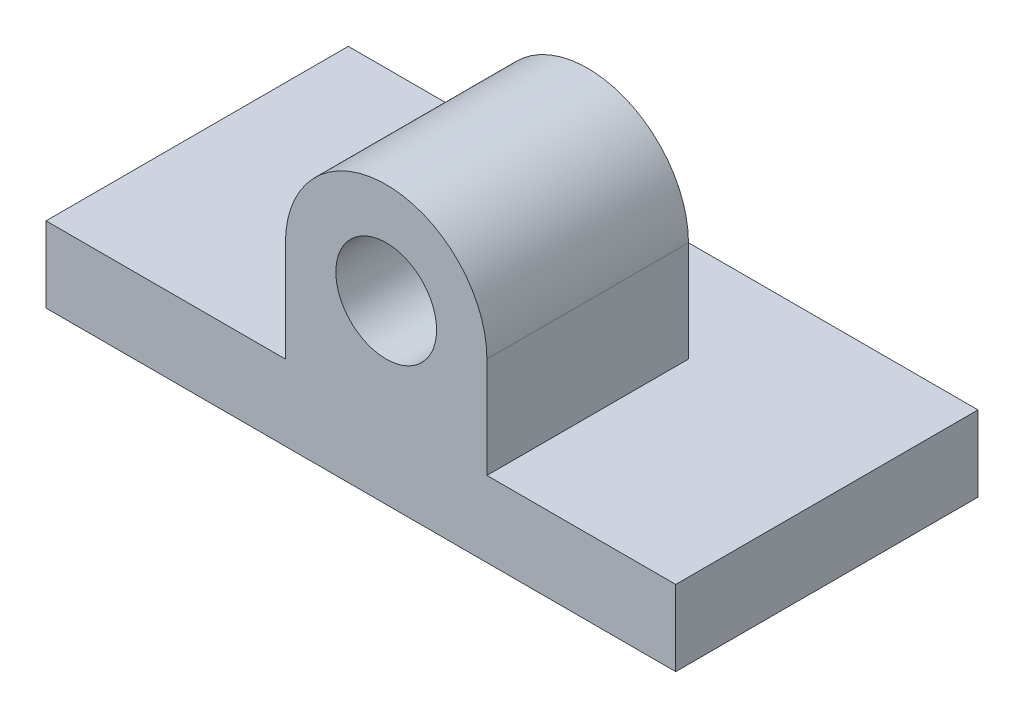
from build123d import *

# Parameters (mm, degrees)
SKETCH1_W           = 125
SKETCH1_H           = 15
BOSS_EXTRUDE1_DEPTH = 60
SKETCH1_3_R         = 10
BOSS_EXTRUDE2_DEPTH = 40


with BuildPart() as part:
    # Sketch1 → Boss-Extrude1 (new body)
    with BuildSketch(Plane.XY):
        with Locations((62.5, 7.5)):
            Rectangle(SKETCH1_W, SKETCH1_H)
    extrude(amount=-BOSS_EXTRUDE1_DEPTH)

    # Sketch1<3> → Boss-Extrude2 (add)
    with BuildSketch(Plane.XY):
        with BuildLine():
            Line((47.527127473, 15), (87.527127473, 15))
            Line((87.527127473, 15), (87.527127473, 35))
            ThreePointArc((87.527127473, 35), (67.527127473, 55), (47.527127473, 35))
            Line((47.527127473, 35), (47.527127473, 15))
        make_face()
        with Locations((67.527127473, 35)):
            Circle(SKETCH1_3_R, mode=Mode.SUBTRACT)
    extrude(amount=-BOSS_EXTRUDE2_DEPTH)


solid = part.part
